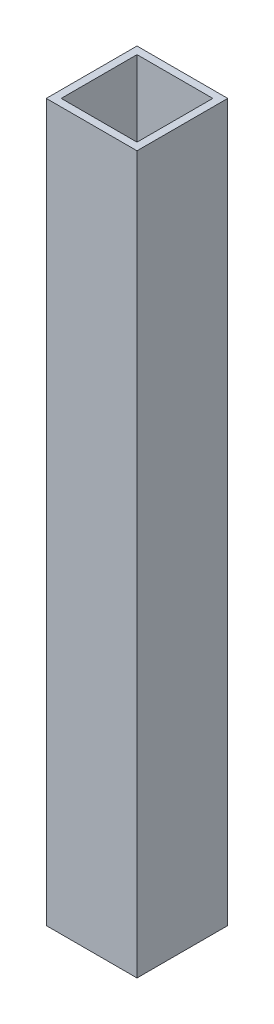
from build123d import *

# Parameters (mm, degrees)
SKETCH1_W           = 19.304
SKETCH1_H           = 19.304
SKETCH1_W_2         = 16.129
SKETCH1_H_2         = 16.129
BOSS_EXTRUDE1_DEPTH = 76.2


with BuildPart() as part:
    # Sketch1 → Boss-Extrude1 (new, symmetric)
    with BuildSketch(Plane(origin=(0, 0, 0), x_dir=(1, 0, 0), z_dir=(0, 1, 0))):
        Rectangle(SKETCH1_W, SKETCH1_H)
        Rectangle(SKETCH1_W_2, SKETCH1_H_2, mode=Mode.SUBTRACT)
    extrude(amount=BOSS_EXTRUDE1_DEPTH, both=True)


solid = part.part
